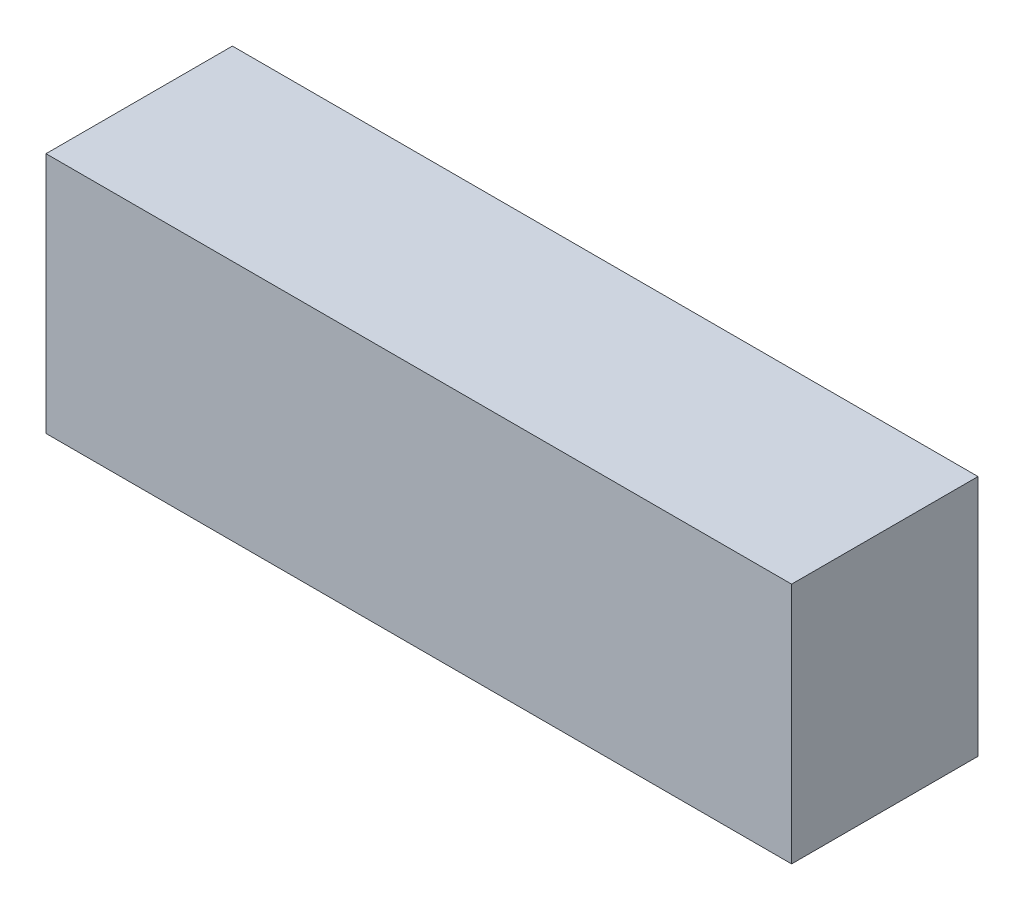
from build123d import *

# Parameters (mm, degrees)
SKETCH1_W           = 40
SKETCH1_H           = 13
BOSS_EXTRUDE1_DEPTH = 10


with BuildPart() as part:
    # Sketch1 → Boss-Extrude1 (new body)
    with BuildSketch(Plane.XY):
        with Locations((20, 6.5)):
            Rectangle(SKETCH1_W, SKETCH1_H)
    extrude(amount=BOSS_EXTRUDE1_DEPTH)


solid = part.part
